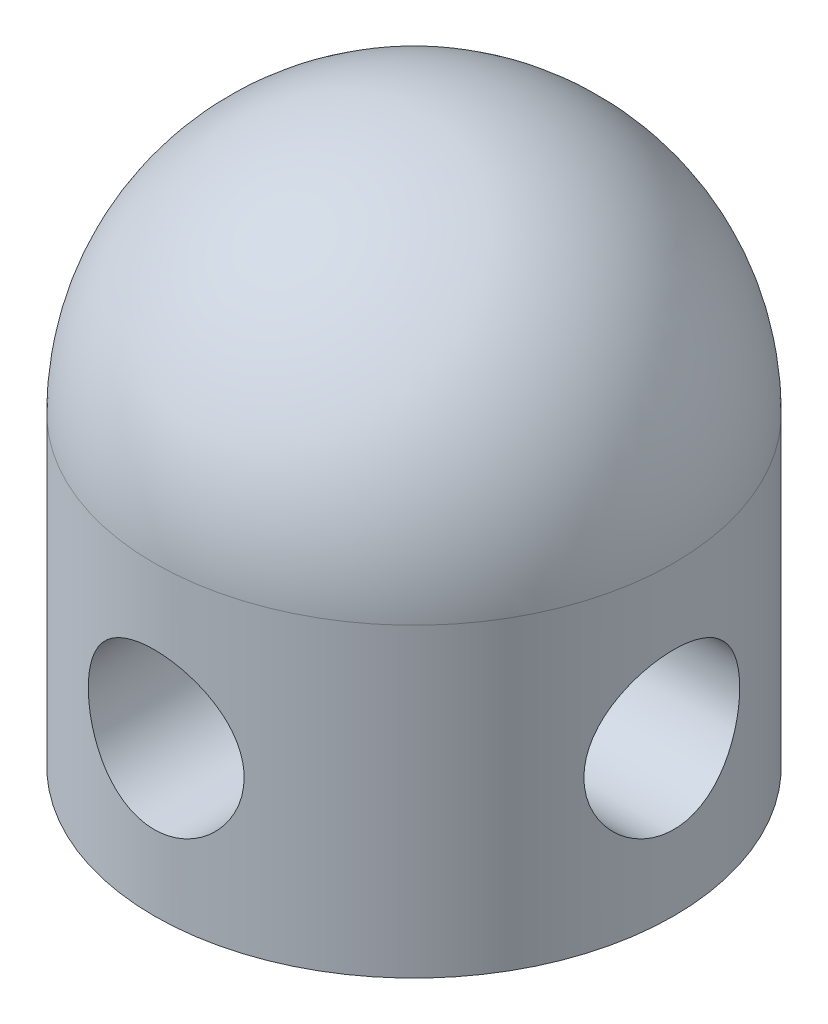
from build123d import *

# Parameters (mm, degrees)
CIRKEL_R                   = 17
CILINDER_DEPTH             = 20
CIRKEL_GAT_R               = 5.1
OPENING_DEPTH              = 10
GATEN_PATROON_COUNT        = 4
CIRKEL1_R                  = 13.5
OPENING_OPZET_DEPTH        = 3
CIRKEL2_R                  = 2
GAT_VERLOOPSTUK_DEPTH      = 8
CIRKEL3_R                  = 3
GAT_VERLOOPSTUK_RAND_DEPTH = 2


with BuildPart() as part:
    # cirkel → cilinder (new body)
    with BuildSketch(Plane(origin=(0, 0, 0), x_dir=(1, 0, 0), z_dir=(0, 1, 0))):
        with Locations(Location((0, 0, 0), (0, 0, 270))):
            Circle(CIRKEL_R)
    extrude(amount=CILINDER_DEPTH)

    # boog → bol (revolve)
    with BuildSketch(Plane.XY):
        with BuildLine():
            Line((0, 20), (0, 37))
            ThreePointArc((0, 37), (-12.02081528, 32.02081528), (-17, 20))
            Line((-17, 20), (0, 20))
        make_face()
    revolve(axis=Axis((0, 20, 0), (0, 1, 0)))

    # cirkel_gat → opening (cut)
    with BuildSketch(Plane.XY.offset(17)):
        with Locations((0, 10)):
            Circle(CIRKEL_GAT_R)
    opening = extrude(amount=-OPENING_DEPTH, mode=Mode.SUBTRACT)

    # gaten_patroon: opening ×4 about axis
    gaten_patroon_axis = Axis((0, 0, 0), (0, 1, 0))
    for i in range(1, GATEN_PATROON_COUNT):
        add(opening.rotate(gaten_patroon_axis, i * 360 / GATEN_PATROON_COUNT), mode=Mode.SUBTRACT)

    # cirkel1 → opening_opzet (cut)
    with BuildSketch(Plane(origin=(0, 0, 0), x_dir=(-1, 0, 0), z_dir=(0, -1, 0))):
        with Locations(Location((0, 0, 0), (0, 0, 90))):
            Circle(CIRKEL1_R)
    extrude(amount=-OPENING_OPZET_DEPTH, mode=Mode.SUBTRACT)

    # cirkel2 → gat_verloopstuk (cut)
    with BuildSketch(Plane(origin=(0, 3, 0), x_dir=(-1, 0, 0), z_dir=(0, -1, 0))):
        with Locations(Location((0, 0, 0), (0, 0, 90))):
            Circle(CIRKEL2_R)
    extrude(amount=-GAT_VERLOOPSTUK_DEPTH, mode=Mode.SUBTRACT)

    # cirkel3 → gat_verloopstuk_rand (cut)
    with BuildSketch(Plane.XZ.offset(-3)):
        with Locations(Location((0, 0, 0), (0, 0, 270))):
            Circle(CIRKEL3_R)
    extrude(amount=-GAT_VERLOOPSTUK_RAND_DEPTH, mode=Mode.SUBTRACT)


solid = part.part
